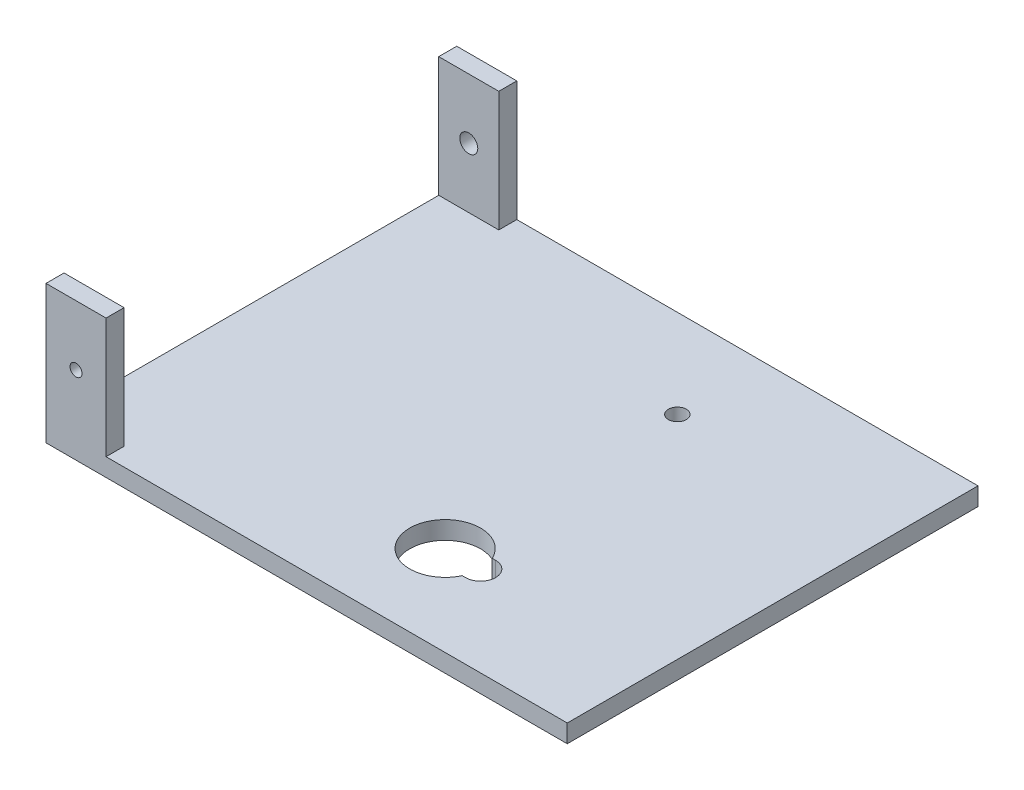
from build123d import *

# Parameters (mm, degrees)
SKETCH1_W           = 86.8
SKETCH1_H           = 68.4
BOSS_EXTRUDE1_DEPTH = 3
SKETCH2_W           = 10
SKETCH2_H           = 3
BOSS_EXTRUDE2_DEPTH = 20
SKETCH3_W           = 10
SKETCH3_H           = 3
BOSS_EXTRUDE3_DEPTH = 20
SKETCH4_R           = 1
CUT_EXTRUDE1_DEPTH  = 20
SKETCH5_R           = 1.5
CUT_EXTRUDE2_DEPTH  = 20
SKETCH8_R           = 1.5
CUT_EXTRUDE3_DEPTH  = 20
CUT_EXTRUDE4_DEPTH  = 10


with BuildPart() as part:
    # Sketch1 → Boss-Extrude1 (new body)
    with BuildSketch(Plane(origin=(0, 0, 0), x_dir=(1, 0, 0), z_dir=(0, 1, 0))):
        with Locations((43.4, -34.2)):
            Rectangle(SKETCH1_W, SKETCH1_H)
    extrude(amount=BOSS_EXTRUDE1_DEPTH)

    # Sketch2 → Boss-Extrude2 (add)
    with BuildSketch(Plane(origin=(0, 3, 0), x_dir=(1, 0, 0), z_dir=(0, 1, 0))):
        with Locations((5, -66.9)):
            Rectangle(SKETCH2_W, SKETCH2_H)
    extrude(amount=BOSS_EXTRUDE2_DEPTH)

    # Sketch3 → Boss-Extrude3 (add)
    with BuildSketch(Plane(origin=(0, 3, 0), x_dir=(1, 0, 0), z_dir=(0, 1, 0))):
        with Locations((5, -1.5)):
            Rectangle(SKETCH3_W, SKETCH3_H)
    extrude(amount=BOSS_EXTRUDE3_DEPTH)

    # Sketch4 → Cut-Extrude1 (cut)
    with BuildSketch(Plane.XY.offset(68.4)):
        with Locations((5, 13)):
            Circle(SKETCH4_R)
    extrude(amount=-CUT_EXTRUDE1_DEPTH, mode=Mode.SUBTRACT)

    # Sketch5 → Cut-Extrude2 (cut)
    with BuildSketch(Plane.XY.offset(3)):
        with Locations((5, 13)):
            Circle(SKETCH5_R)
    extrude(amount=-CUT_EXTRUDE2_DEPTH, mode=Mode.SUBTRACT)

    # Sketch8 → Cut-Extrude3 (cut)
    with BuildSketch(Plane.XZ):
        with Locations(Location((51.465174946, 53.4, 0), (0, 0, 270))):
            Circle(SKETCH8_R)
        with Locations(Location((51.465174946, 14.730831909, 0), (0, 0, 270))):
            Circle(SKETCH8_R)
    extrude(amount=-CUT_EXTRUDE3_DEPTH, mode=Mode.SUBTRACT)

    # Sketch9 → Cut-Extrude4 (cut)
    with BuildSketch(Plane.XZ):
        with BuildLine():
            Line((56.809330632, 55.9), (57.369330632, 55.9))
            ThreePointArc((57.369330632, 55.9), (59.869330632, 53.4), (57.369330632, 50.9))
            Line((57.369330632, 50.9), (56.809330632, 50.9))
            ThreePointArc((56.809330632, 50.9), (45.565174946, 53.4), (56.809330632, 55.9))
        make_face()
    extrude(amount=-CUT_EXTRUDE4_DEPTH, mode=Mode.SUBTRACT)


solid = part.part
